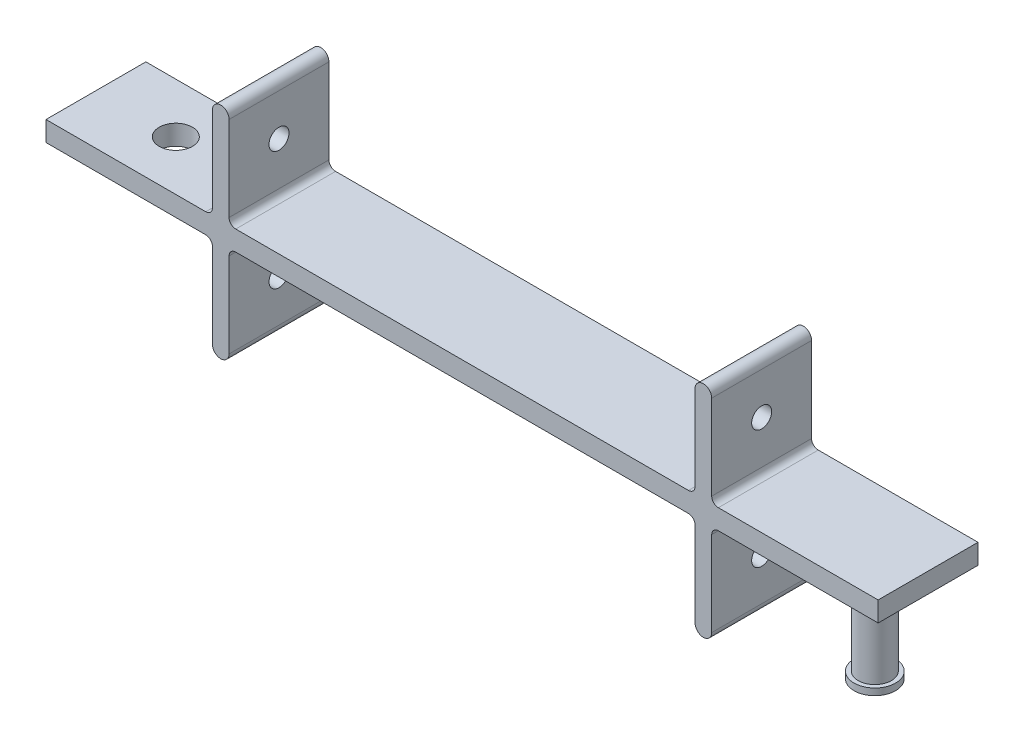
from build123d import *

# Parameters (mm, degrees)
BOSS_EXTRUDE1_DEPTH  = 30
FILLET1_R            = 2
FILLET2_RADIUS       = 2.5
FILLET2_LENGTH       = 30
FILLET3_RADIUS       = 2.5
FILLET3_LENGTH       = 30
FILLET4_R            = 2
SKETCH2_R            = 3
CUT_EXTRUDE4_DEPTH   = 163
SKETCH9_W            = 10
SKETCH9_H            = 6
BOSS_EXTRUDE8_DEPTH  = 30
SKETCH14_W           = 20
SKETCH14_H           = 6
BOSS_EXTRUDE12_DEPTH = 30
FILLET10_RADIUS      = 2.5
FILLET10_LENGTH      = 30
FILLET11_RADIUS      = 2.5
FILLET11_LENGTH      = 30
FILLET12_R           = 2
SKETCH16_R           = 3
CUT_EXTRUDE6_DEPTH   = 200
SKETCH17_W           = 30
SKETCH17_H           = 6
BOSS_EXTRUDE15_DEPTH = 30
SKETCH20_R           = 5
BOSS_EXTRUDE16_DEPTH = 30
SKETCH21_R           = 6.25
BOSS_EXTRUDE17_DEPTH = 2
SKETCH22_R           = 5
CUT_EXTRUDE7_DEPTH   = 10


with BuildPart() as part:
    # Sketch1 → Boss-Extrude1 (new body)
    with BuildSketch(Plane.XY):
        Polygon((-28.863636364, 0), (-48.863636364, 0), (-48.863636364, -30), (-53.863636364, -30), (-53.863636364, 0), (-193.863636364, 0), (-193.863636364, -30), (-198.863636364, -30), (-198.863636364, 0), (-218.863636364, 0), (-218.863636364, 6), (-198.863636364, 6), (-198.863636364, 36), (-193.863636364, 36), (-193.863636364, 6), (-53.863636364, 6), (-53.863636364, 36), (-48.863636364, 36), (-48.863636364, 6), (-28.863636364, 6), align=None)
    extrude(amount=BOSS_EXTRUDE1_DEPTH)

    # Fillet1
    fillet1_edges = [part.edges().sort_by_distance(p)[0] for p in [
        (-198.863636364, 6, 15),
        (-193.863636364, 6, 15),
    ]]
    fillet(fillet1_edges, radius=FILLET1_R)

    # Fillet2: full round fillet: the end face becomes a half cylinder, R = half its width
    fillet2_face = Plane((-196.363636364, 36, 15), x_dir=(0, 0, 1), z_dir=(0, 1, 0))  # on the end face: x along it, z out of the body
    fillet2_slab = fillet2_face.offset(-FILLET2_RADIUS / 2) * Box(FILLET2_LENGTH, 2 * FILLET2_RADIUS, FILLET2_RADIUS, mode=Mode.PRIVATE)  # the body's end, R deep
    fillet2_round = Plane((-196.363636364, 33.5, 15), x_dir=(0, 1, 0), z_dir=(0, 0, 1)) * Cylinder(FILLET2_RADIUS, FILLET2_LENGTH, mode=Mode.PRIVATE)  # its axis R under the face
    add(fillet2_slab - fillet2_round, mode=Mode.SUBTRACT)

    # Fillet3: full round fillet: the end face becomes a half cylinder, R = half its width
    fillet3_face = Plane((-51.363636364, 36, 15), x_dir=(0, 0, 1), z_dir=(0, 1, 0))  # on the end face: x along it, z out of the body
    fillet3_slab = fillet3_face.offset(-FILLET3_RADIUS / 2) * Box(FILLET3_LENGTH, 2 * FILLET3_RADIUS, FILLET3_RADIUS, mode=Mode.PRIVATE)  # the body's end, R deep
    fillet3_round = Plane((-51.363636364, 33.5, 15), x_dir=(0, 1, 0), z_dir=(0, 0, 1)) * Cylinder(FILLET3_RADIUS, FILLET3_LENGTH, mode=Mode.PRIVATE)  # its axis R under the face
    add(fillet3_slab - fillet3_round, mode=Mode.SUBTRACT)

    # Fillet4
    fillet4_edges = [part.edges().sort_by_distance(p)[0] for p in [
        (-53.863636364, 6, 15),
        (-48.863636364, 6, 15),
    ]]
    fillet(fillet4_edges, radius=FILLET4_R)

    # Sketch2 → Cut-Extrude4 (cut)
    with BuildSketch(Plane.ZY.offset(198.863636364)):
        with Locations((15, 21)):
            Circle(SKETCH2_R)
    extrude(amount=-CUT_EXTRUDE4_DEPTH, mode=Mode.SUBTRACT)

    # Sketch9 → Boss-Extrude8 (add)
    with BuildSketch(Plane(origin=(0, 0, 0), x_dir=(-1, 0, 0), z_dir=(0, 0, -1))):
        with Locations((223.863636364, 3)):
            Rectangle(SKETCH9_W, SKETCH9_H)
    extrude(amount=-BOSS_EXTRUDE8_DEPTH)

    # Sketch14 → Boss-Extrude12 (add)
    with BuildSketch(Plane(origin=(0, 0, 0), x_dir=(-1, 0, 0), z_dir=(0, 0, -1))):
        with Locations((238.863636364, 3)):
            Rectangle(SKETCH14_W, SKETCH14_H)
    extrude(amount=-BOSS_EXTRUDE12_DEPTH)

    # Fillet10: full round fillet: the end face becomes a half cylinder, R = half its width
    fillet10_face = Plane((-51.363636364, -30, 15), x_dir=(0, 0, 1), z_dir=(0, -1, 0))  # on the end face: x along it, z out of the body
    fillet10_slab = fillet10_face.offset(-FILLET10_RADIUS / 2) * Box(FILLET10_LENGTH, 2 * FILLET10_RADIUS, FILLET10_RADIUS, mode=Mode.PRIVATE)  # the body's end, R deep
    fillet10_round = Plane((-51.363636364, -27.5, 15), x_dir=(0, -1, 0), z_dir=(0, 0, 1)) * Cylinder(FILLET10_RADIUS, FILLET10_LENGTH, mode=Mode.PRIVATE)  # its axis R under the face
    add(fillet10_slab - fillet10_round, mode=Mode.SUBTRACT)

    # Fillet11: full round fillet: the end face becomes a half cylinder, R = half its width
    fillet11_face = Plane((-196.363636364, -30, 15), x_dir=(0, 0, 1), z_dir=(0, -1, 0))  # on the end face: x along it, z out of the body
    fillet11_slab = fillet11_face.offset(-FILLET11_RADIUS / 2) * Box(FILLET11_LENGTH, 2 * FILLET11_RADIUS, FILLET11_RADIUS, mode=Mode.PRIVATE)  # the body's end, R deep
    fillet11_round = Plane((-196.363636364, -27.5, 15), x_dir=(0, -1, 0), z_dir=(0, 0, 1)) * Cylinder(FILLET11_RADIUS, FILLET11_LENGTH, mode=Mode.PRIVATE)  # its axis R under the face
    add(fillet11_slab - fillet11_round, mode=Mode.SUBTRACT)

    # Fillet12
    fillet12_edges = [part.edges().sort_by_distance(p)[0] for p in [
        (-48.863636364, 0, 15),
        (-53.863636364, 0, 15),
        (-193.863636364, 0, 15),
        (-198.863636364, 0, 15),
    ]]
    fillet(fillet12_edges, radius=FILLET12_R)

    # Sketch16 → Cut-Extrude6 (cut)
    with BuildSketch(Plane(origin=(-48.863636364, 0, 0), x_dir=(0, 0, -1), z_dir=(1, 0, 0))):
        with Locations(Location((-15, -14.75, 0), (0, 0, 90))):
            Circle(SKETCH16_R)
    extrude(amount=-CUT_EXTRUDE6_DEPTH, mode=Mode.SUBTRACT)

    # Sketch17 → Boss-Extrude15 (add)
    with BuildSketch(Plane(origin=(0, 0, 0), x_dir=(-1, 0, 0), z_dir=(0, 0, -1))):
        with Locations((13.863636364, 3)):
            Rectangle(SKETCH17_W, SKETCH17_H)
    extrude(amount=-BOSS_EXTRUDE15_DEPTH)

    # Sketch20 → Boss-Extrude16 (add)
    with BuildSketch(Plane(origin=(0, 0, 0), x_dir=(-1, 0, 0), z_dir=(0, -1, 0))):
        with Locations(Location((14.863636364, -15, 0), (0, 0, 270))):
            Circle(SKETCH20_R)
    extrude(amount=BOSS_EXTRUDE16_DEPTH)

    # Sketch21 → Boss-Extrude17 (add)
    with BuildSketch(Plane.XZ.offset(30)):
        with Locations(Location((-14.863636364, 15, 0), (0, 0, 270))):
            Circle(SKETCH21_R)
    extrude(amount=-BOSS_EXTRUDE17_DEPTH)

    # Sketch22 → Cut-Extrude7 (cut)
    with BuildSketch(Plane(origin=(0, 6, 0), x_dir=(1, 0, 0), z_dir=(0, 1, 0))):
        with Locations(Location((-224.863636364, -15, 0), (0, 0, 180))):
            Circle(SKETCH22_R)
    extrude(amount=-CUT_EXTRUDE7_DEPTH, mode=Mode.SUBTRACT)


solid = part.part
